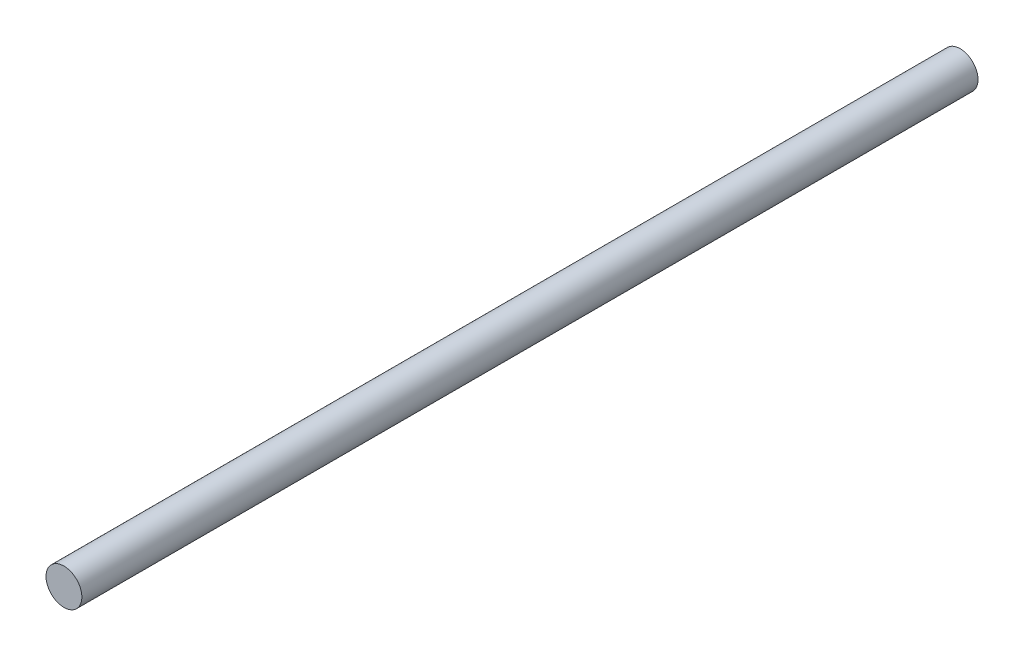
from build123d import *

# Parameters (mm, degrees)
SKETCH1_R           = 6.35
BOSS_EXTRUDE1_DEPTH = 317.5


with BuildPart() as part:
    # Sketch1 → Boss-Extrude1 (new body)
    with BuildSketch(Plane.XY):
        with Locations(Location((0, 0, 0), (0, 0, 180))):
            Circle(SKETCH1_R)
    extrude(amount=BOSS_EXTRUDE1_DEPTH)


solid = part.part
